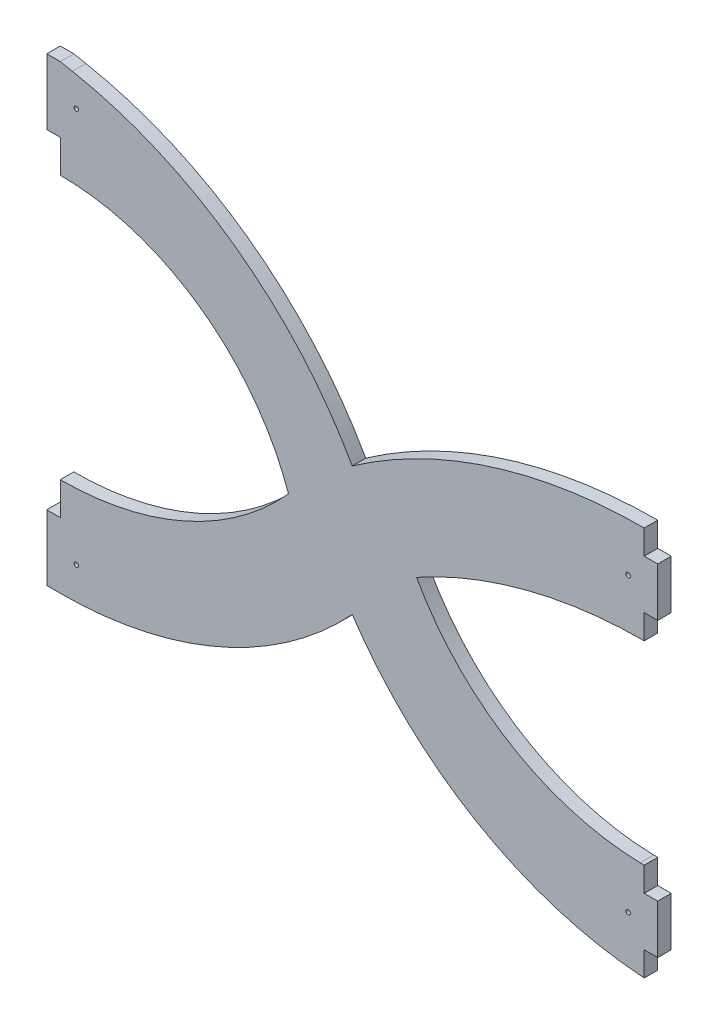
from build123d import *

# Parameters (mm, degrees)
SKETCH1_W           = 241.3
SKETCH1_H           = 198.12
BOSS_EXTRUDE1_DEPTH = 5.334
SKETCH2_W           = 5.334
SKETCH2_H           = 9.652
SKETCH2_H_2         = 96.012
SKETCH2_H_3         = 53.848
CUT_EXTRUDE1_DEPTH  = 179.277190048
SKETCH3_W           = 5.334
SKETCH3_H           = 16.256
SKETCH3_H_2         = 130.048
CUT_EXTRUDE2_DEPTH  = 179.277190048
CUT_EXTRUDE5_DEPTH  = 179.277190048
CUT_EXTRUDE6_DEPTH  = 179.277190048
CUT_EXTRUDE7_DEPTH  = 179.277190048
SKETCH8_R           = 0.889
CUT_EXTRUDE8_DEPTH  = 179.277190048
SKETCH9_R           = 0.889
CUT_EXTRUDE9_DEPTH  = 179.277190048


with BuildPart() as part:
    # Sketch1 → Boss-Extrude1 (new body)
    with BuildSketch(Plane.XY):
        with Locations((-21.329797884, -8.624919689)):
            Rectangle(SKETCH1_W, SKETCH1_H)
    extrude(amount=BOSS_EXTRUDE1_DEPTH)

    # Sketch2 → Cut-Extrude1 (cut, through all)
    with BuildSketch(Plane.XY.offset(5.334)):
        with Locations((96.653202116, -102.858919689)):
            Rectangle(SKETCH2_W, SKETCH2_H)
        with Locations((96.653202116, -30.722919689)):
            Rectangle(SKETCH2_W, SKETCH2_H_2)
        with Locations((96.653202116, 63.511080311)):
            Rectangle(SKETCH2_W, SKETCH2_H_3)
    extrude(amount=-CUT_EXTRUDE1_DEPTH, mode=Mode.SUBTRACT)

    # Sketch3 → Cut-Extrude2 (cut, through all)
    with BuildSketch(Plane.XY.offset(5.334)):
        with Locations((-139.312797884, -99.556919689)):
            Rectangle(SKETCH3_W, SKETCH3_H)
        with Locations((-139.312797884, -0.496919689)):
            Rectangle(SKETCH3_W, SKETCH3_H_2)
    extrude(amount=-CUT_EXTRUDE2_DEPTH, mode=Mode.SUBTRACT)

    # Sketch5 → Cut-Extrude5 (cut, through all)
    with BuildSketch(Plane.XY.offset(5.334)):
        Polygon((-136.645797884, -91.428919689), (93.986202116, -107.684919689), (93.986202116, -162.860416997), (-136.645797884, -146.604416997), align=None)
    extrude(amount=-CUT_EXTRUDE5_DEPTH, mode=Mode.SUBTRACT)

    # Sketch6 → Cut-Extrude6 (cut, through all)
    with BuildSketch(Plane.XY.offset(5.334)):
        Polygon((-136.645797884, 90.435080311), (93.986202116, 46.239080311), (93.986202116, 90.435080311), (-136.645797884, 134.631080311), align=None)
    extrude(amount=-CUT_EXTRUDE6_DEPTH, mode=Mode.SUBTRACT)

    # Sketch7 → Cut-Extrude7 (cut, through all)
    with BuildSketch(Plane.XY.offset(5.334)):
        with BuildLine():
            Line((-131.85688859, 89.517381834), (93.986202116, 46.239080311))
            ThreePointArc((93.986202116, 46.239080311), (33.516562096, 36.909943164), (-21.329797884, 9.790080311))
            ThreePointArc((-21.329797884, 9.790080311), (-67.77177066, 61.883202454), (-131.85688859, 89.517381834))
        make_face()
        with BuildLine():
            Line((-136.645797884, -91.428919689), (93.309245371, -107.637204677))
            ThreePointArc((93.309245371, -107.637204677), (28.257929174, -87.626903784), (-21.329797884, -41.009919689))
            ThreePointArc((-21.329797884, -41.009919689), (-73.717554191, -78.2732768), (-136.645797884, -91.428919689))
        make_face()
        with BuildLine():
            ThreePointArc((93.986202116, 7.631080311), (47.550679246, 1.726898301), (4.070202116, -15.609919689))
            ThreePointArc((4.070202116, -15.609919689), (41.092439587, -54.093369858), (92.347831876, -69.076919689))
            ThreePointArc((92.347831876, -69.076919689), (131.631647498, -31.544467715), (93.986202116, 7.631080311))
        make_face()
        with BuildLine():
            ThreePointArc((-136.645797884, 51.573080311), (-81.408536453, 33.982932584), (-46.514432981, -12.3092902))
            ThreePointArc((-46.514432981, -12.3092902), (-87.289086913, -42.04513502), (-136.645797884, -52.566919689))
            ThreePointArc((-136.645797884, -52.566919689), (-188.715797884, -0.496919689), (-136.645797884, 51.573080311))
        make_face()
    extrude(amount=-CUT_EXTRUDE7_DEPTH, mode=Mode.SUBTRACT)

    # Sketch8 → Cut-Extrude8 (cut, through all)
    with BuildSketch(Plane.XY.offset(5.334)):
        with Locations((-130.295797884, 77.481080311)):
            Circle(SKETCH8_R)
        with Locations(Location((-130.295797884, -78.474919689, 0), (0, 0, 180))):
            Circle(SKETCH8_R)
    extrude(amount=-CUT_EXTRUDE8_DEPTH, mode=Mode.SUBTRACT)

    # Sketch9 → Cut-Extrude9 (cut, through all)
    with BuildSketch(Plane.XY.offset(5.334)):
        with Locations((87.636202116, 26.935080311)):
            Circle(SKETCH9_R)
        with Locations(Location((87.636202116, -88.380919689, 0), (0, 0, 180))):
            Circle(SKETCH9_R)
    extrude(amount=-CUT_EXTRUDE9_DEPTH, mode=Mode.SUBTRACT)


solid = part.part
